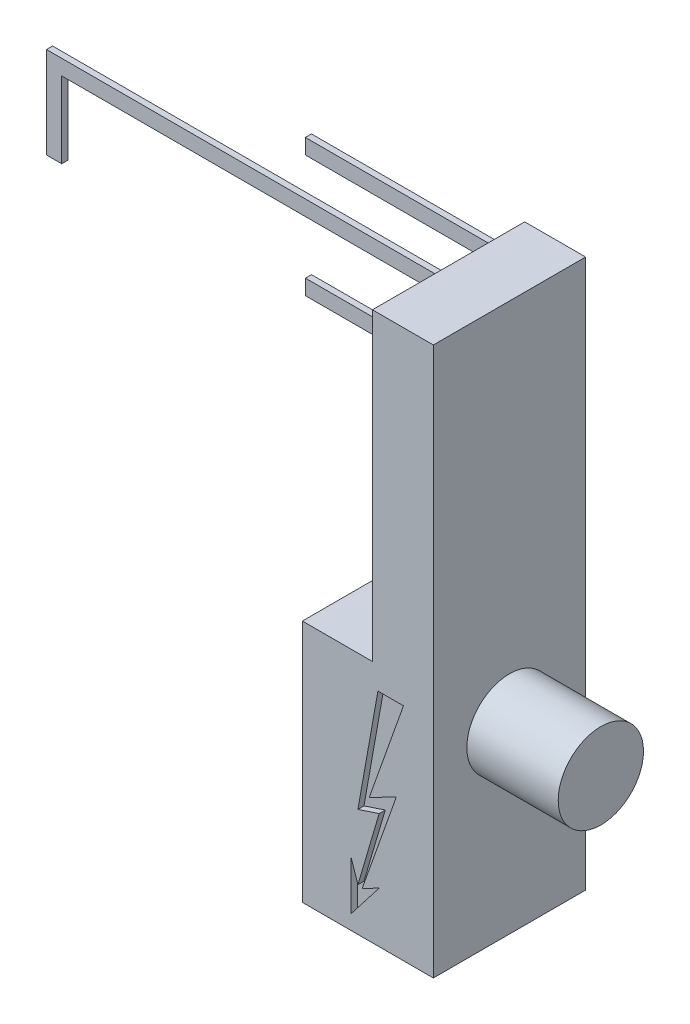
from build123d import *

# Parameters (mm, degrees)
BOSS_EXTRUDE1_DEPTH   = 12.5
CUT_EXTRUDE1_DEPTH    = 1
SKETCH4_W             = 35
SKETCH4_H             = 2.5
BOSS_EXTRUDE2_DEPTH   = 1
BOSS_EXTRUDE2_2_DEPTH = 1
BOSS_EXTRUDE2_3_DEPTH = 1
SKETCH6_R             = 7
BOSS_EXTRUDE3_DEPTH   = 15


with BuildPart() as part:
    # Sketch1 → Boss-Extrude1 (new, symmetric)
    with BuildSketch(Plane.XY):
        Polygon((-15, -45), (6.5, -45), (6.5, 45), (-3.5, 45), (-3.5, -5), (-15, -5), align=None)
    extrude(amount=BOSS_EXTRUDE1_DEPTH, both=True)

    # Sketch2 → Cut-Extrude1 (cut)
    with BuildSketch(Plane.XY.offset(12.5)):
        Polygon((-2.597622066, -8.753911623), (-5.881737798, -27.227062612), (-2.387698703, -26.062382913), (-5.881737798, -37.920939842), (-6.984975478, -34.6112268), (-6.984975478, -42.59710263), (-2.387698703, -36.660968168), (-5.186296848, -38.12584655), (0.436139273, -22.279056437), (-4.028838278, -24.616172646), (1.599086918, -8.753911623), align=None)
    extrude(amount=-CUT_EXTRUDE1_DEPTH, mode=Mode.SUBTRACT)

    # Sketch6 → Boss-Extrude3 (add)
    with BuildSketch(Plane(origin=(6.5, 0, 0), x_dir=(0, 0, -1), z_dir=(1, 0, 0))):
        with Locations(Location((0, -15, 0), (0, 0, 180))):
            Circle(SKETCH6_R)
    extrude(amount=BOSS_EXTRUDE3_DEPTH)


with BuildPart() as body_2:
    # Sketch4 → Boss-Extrude2 (new body)
    with BuildSketch(Plane(origin=(0, 0, -12.5), x_dir=(-1, 0, 0), z_dir=(0, 0, -1))):
        with Locations((21, 38.75)):
            Rectangle(SKETCH4_W, SKETCH4_H)
    extrude(amount=-BOSS_EXTRUDE2_DEPTH)


with BuildPart() as body_3:
    # Sketch4 → Boss-Extrude2 2 (new body)
    with BuildSketch(Plane(origin=(0, 0, -12.5), x_dir=(-1, 0, 0), z_dir=(0, 0, -1))):
        with Locations((21, 18.75)):
            Rectangle(SKETCH4_W, SKETCH4_H)
    extrude(amount=-BOSS_EXTRUDE2_2_DEPTH)


with BuildPart() as body_4:
    # Sketch4 → Boss-Extrude2 3 (new body)
    with BuildSketch(Plane(origin=(0, 0, -12.5), x_dir=(-1, 0, 0), z_dir=(0, 0, -1))):
        Polygon((3.5, 31.25), (78.5, 31.25), (81, 31.25), (81, 16.25), (78.5, 16.25), (78.5, 28.75), (3.5, 28.75), align=None)
    extrude(amount=-BOSS_EXTRUDE2_3_DEPTH)


solid = Compound([part.part, body_2.part, body_3.part, body_4.part])
